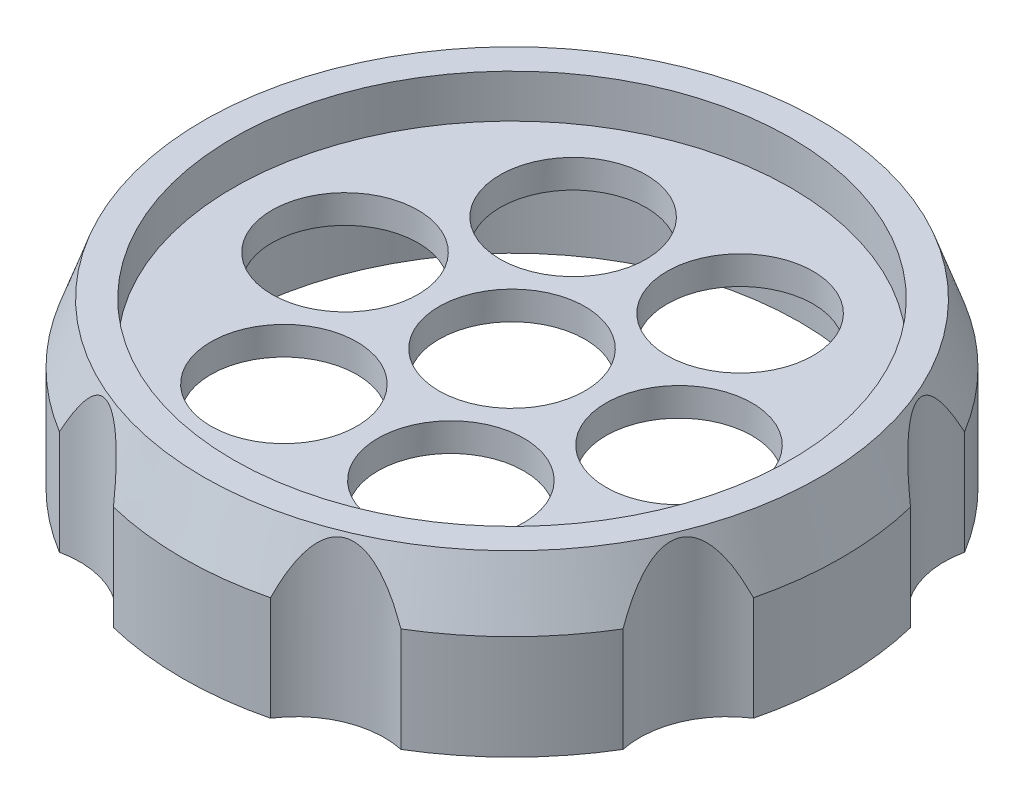
from build123d import *

# Parameters (mm, degrees)
CROQUIS1_R              = 11.05
SALIENTE_EXTRUIR1_DEPTH = 5.5
CHAFL_N1_SIZE           = 2
CHAFL_N1_SIZE2          = 0.7
CROQUIS2_R              = 9.35
CORTAR_EXTRUIR1_DEPTH   = 1.45
CROQUIS3_R              = 9.65
CORTAR_EXTRUIR2_DEPTH   = 3.1
CROQUIS4_R              = 2.45
CORTAR_EXTRUIR3_DEPTH   = 0.95
CROQUIS5_R              = 2.94693617
CORTAR_EXTRUIR4_DEPTH   = 7


with BuildPart() as part:
    # Croquis1 → Saliente-Extruir1 (new body)
    with BuildSketch(Plane(origin=(0, 0, 0), x_dir=(1, 0, 0), z_dir=(0, 1, 0))):
        with Locations(Location((0, 0, 0), (0, 0, 270))):
            Circle(CROQUIS1_R)
    extrude(amount=SALIENTE_EXTRUIR1_DEPTH)

    # Chaflán1
    chafl_n1_edges = [part.edges().sort_by_distance(p)[0] for p in [
        (0, 5.5, -11.05),
    ]]
    chafl_n1_side = [part.faces().sort_by_distance(p)[0] for p in [
        (0, 2.75, -11.05),
    ]]
    chamfer(chafl_n1_edges, length=CHAFL_N1_SIZE, length2=CHAFL_N1_SIZE2, reference=chafl_n1_side[0])

    # Croquis2 → Cortar-Extruir1 (cut)
    with BuildSketch(Plane(origin=(0, 5.5, 0), x_dir=(1, 0, 0), z_dir=(0, 1, 0))):
        with Locations(Location((0, 0, 0), (0, 0, 270))):
            Circle(CROQUIS2_R)
    extrude(amount=-CORTAR_EXTRUIR1_DEPTH, mode=Mode.SUBTRACT)

    # Croquis3 → Cortar-Extruir2 (cut)
    with BuildSketch(Plane.XZ):
        with Locations(Location((0, 0, 0), (0, 0, 270))):
            Circle(CROQUIS3_R)
    extrude(amount=-CORTAR_EXTRUIR2_DEPTH, mode=Mode.SUBTRACT)

    # Croquis4 → Cortar-Extruir3 (cut)
    with BuildSketch(Plane(origin=(0, 4.05, 0), x_dir=(1, 0, 0), z_dir=(0, 1, 0))):
        with Locations(Location((0, 0, 0), (0, 0, 270))):
            Circle(CROQUIS4_R)
        with Locations(Location((5.6, 0, 0), (0, 0, 270))):
            Circle(CROQUIS4_R)
        with Locations(Location((2.8, 4.849742261, 0), (0, 0, 270))):
            Circle(CROQUIS4_R)
        with Locations(Location((-2.8, 4.849742261, 0), (0, 0, 270))):
            Circle(CROQUIS4_R)
        with Locations(Location((-5.6, 0, 0), (0, 0, 270))):
            Circle(CROQUIS4_R)
        with Locations(Location((-2.8, -4.849742261, 0), (0, 0, 270))):
            Circle(CROQUIS4_R)
        with Locations(Location((2.8, -4.849742261, 0), (0, 0, 270))):
            Circle(CROQUIS4_R)
    extrude(amount=-CORTAR_EXTRUIR3_DEPTH, mode=Mode.SUBTRACT)

    # Croquis5 → Cortar-Extruir4 (cut)
    with BuildSketch(Plane.XZ):
        with Locations((5.107651345, 12.330961149)):
            Circle(CROQUIS5_R)
        with Locations((12.330961149, 5.107651345)):
            Circle(CROQUIS5_R)
        with Locations((12.330961149, -5.107651345)):
            Circle(CROQUIS5_R)
        with Locations((5.107651345, -12.330961149)):
            Circle(CROQUIS5_R)
        with Locations((-5.107651345, -12.330961149)):
            Circle(CROQUIS5_R)
        with Locations((-12.330961149, -5.107651345)):
            Circle(CROQUIS5_R)
        with Locations((-12.330961149, 5.107651345)):
            Circle(CROQUIS5_R)
        with Locations((-5.107651345, 12.330961149)):
            Circle(CROQUIS5_R)
    extrude(amount=-CORTAR_EXTRUIR4_DEPTH, mode=Mode.SUBTRACT)


solid = part.part
